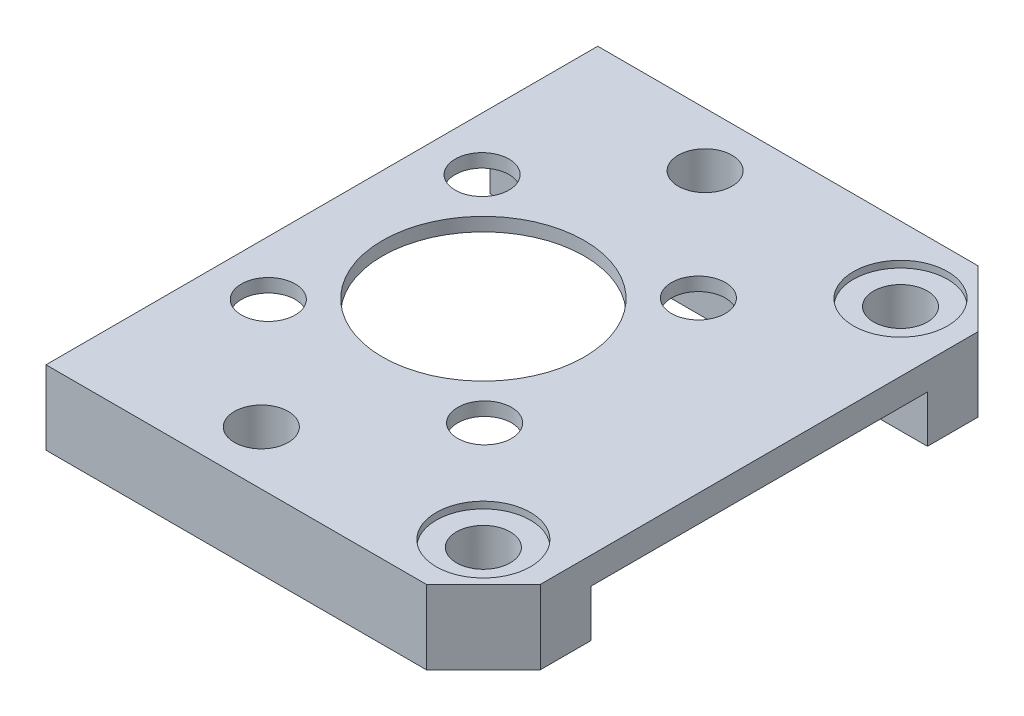
from build123d import *

# Parameters (mm, degrees)
SKETCH2_W           = 41
SKETCH2_H           = 41
BOSS_EXTRUDE1_DEPTH = 2
SKETCH3_R           = 2
CUT_EXTRUDE1_DEPTH  = 30.060282173
SKETCH4_R           = 7.5
CUT_EXTRUDE2_DEPTH  = 30.060282173
SKETCH5_W           = 25
SKETCH5_H           = 25
CUT_EXTRUDE3_DEPTH  = 1
CUT_EXTRUDE4_DEPTH  = 30.060282173
SKETCH7_R           = 2
CUT_EXTRUDE5_DEPTH  = 30.060282173
SKETCH8_W           = 25
SKETCH8_H           = 8
SKETCH8_H_2         = 7.957817611
BOSS_EXTRUDE2_DEPTH = 3.5
SKETCH9_R           = 2
CUT_EXTRUDE6_DEPTH  = 30.508473359
BOSS_EXTRUDE3_START = 3.5
SKETCH10_R          = 2
BOSS_EXTRUDE3_DEPTH = 3.5
SKETCH11_R          = 3.5
CUT_EXTRUDE7_DEPTH  = 3.5
SKETCH12_W          = 8
SKETCH12_H          = 2
BOSS_EXTRUDE4_DEPTH = 3.5
SKETCH13_R          = 3.5
CUT_EXTRUDE8_DEPTH  = 3.5
SKETCH14_R          = 3.5
SKETCH14_R_2        = 2
BOSS_EXTRUDE5_DEPTH = 3
SKETCH15_W          = 16
SKETCH15_H          = 8.042182389
SKETCH15_R          = 2
SKETCH15_H_2        = 8
BOSS_EXTRUDE6_DEPTH = 4
SKETCH16_W          = 8
SKETCH16_H          = 25
CUT_EXTRUDE9_DEPTH  = 3.5
SKETCH18_W          = 32.514718626
SKETCH18_H          = 41
CUT_EXTRUDE10_DEPTH = 4
CUT_EXTRUDE12_DEPTH = 30.508473359


with BuildPart() as part:
    # Sketch2 → Boss-Extrude1 (new body)
    with BuildSketch(Plane(origin=(0, 0, 0), x_dir=(1, 0, 0), z_dir=(0, 1, 0))):
        Rectangle(SKETCH2_W, SKETCH2_H)
    extrude(amount=BOSS_EXTRUDE1_DEPTH)

    # Sketch3 → Cut-Extrude1 (cut, through all)
    with BuildSketch(Plane.XZ):
        with Locations(Location((-7.943181907, 8.037155044, 0), (0, 0, 270))):
            Circle(SKETCH3_R)
        with Locations(Location((8.037155044, 7.943181907, 0), (0, 0, 270))):
            Circle(SKETCH3_R)
        with Locations(Location((7.943181907, -8.037155044, 0), (0, 0, 270))):
            Circle(SKETCH3_R)
        with Locations(Location((-8.037155044, -7.943181907, 0), (0, 0, 270))):
            Circle(SKETCH3_R)
    extrude(amount=-CUT_EXTRUDE1_DEPTH, mode=Mode.SUBTRACT)

    # Sketch4 → Cut-Extrude2 (cut, through all)
    with BuildSketch(Plane(origin=(0, 2, 0), x_dir=(1, 0, 0), z_dir=(0, 1, 0))):
        with Locations(Location((0, 0, 0), (0, 0, 270))):
            Circle(SKETCH4_R)
    extrude(amount=-CUT_EXTRUDE2_DEPTH, mode=Mode.SUBTRACT)

    # Sketch5 → Cut-Extrude3 (cut)
    with BuildSketch(Plane.XZ):
        Rectangle(SKETCH5_W, SKETCH5_H)
    extrude(amount=-CUT_EXTRUDE3_DEPTH, mode=Mode.SUBTRACT)

    # Sketch6 → Cut-Extrude4 (cut, through all)
    with BuildSketch(Plane(origin=(0, 2, 0), x_dir=(1, 0, 0), z_dir=(0, 1, 0))):
        Polygon((-20.5, 16.257359313), (-16.257359313, 20.5), (-20.5, 20.5), align=None)
        Polygon((16.257359313, 20.5), (20.5, 16.257359313), (20.5, 20.5), align=None)
        Polygon((20.5, -16.257359313), (16.257359313, -20.5), (20.5, -20.5), align=None)
        Polygon((-16.257359313, -20.5), (-20.5, -16.257359313), (-20.5, -20.5), align=None)
    extrude(amount=-CUT_EXTRUDE4_DEPTH, mode=Mode.SUBTRACT)

    # Sketch7 → Cut-Extrude5 (cut, through all)
    with BuildSketch(Plane.XZ):
        with Locations(Location((-15.5, 15.5, 0), (0, 0, 270))):
            Circle(SKETCH7_R)
        with Locations(Location((15.5, 15.5, 0), (0, 0, 270))):
            Circle(SKETCH7_R)
        with Locations(Location((15.5, -15.5, 0), (0, 0, 270))):
            Circle(SKETCH7_R)
        with Locations(Location((-15.5, -15.5, 0), (0, 0, 270))):
            Circle(SKETCH7_R)
    extrude(amount=-CUT_EXTRUDE5_DEPTH, mode=Mode.SUBTRACT)

    # Sketch8 → Boss-Extrude2 (add)
    with BuildSketch(Plane.XZ):
        with Locations((0, 16.5)):
            Rectangle(SKETCH8_W, SKETCH8_H)
        with Locations((0, -16.478908806)):
            Rectangle(SKETCH8_W, SKETCH8_H_2)
    extrude(amount=BOSS_EXTRUDE2_DEPTH)

    # Sketch9 → Cut-Extrude6 (cut, through all)
    with BuildSketch(Plane.XZ.offset(3.5)):
        with Locations(Location((0, 16.5, 0), (0, 0, 270))):
            Circle(SKETCH9_R)
        with Locations(Location((0, -16.478908806, 0), (0, 0, 270))):
            Circle(SKETCH9_R)
    extrude(amount=-CUT_EXTRUDE6_DEPTH, mode=Mode.SUBTRACT)

    # Sketch10 → Boss-Extrude3 (add)
    # profile 1 of 3: a face of its own
    with BuildSketch(Plane.XZ.offset(BOSS_EXTRUDE3_START)):
        Polygon((-20.5, 16.257359313), (-20.5, 12.5), (-12.5, 12.5), (-12.5, 20.5), (-16.257359313, 20.5), align=None)
        with Locations(Location((-15.5, 15.5, 0), (0, 0, 270))):
            Circle(SKETCH10_R, mode=Mode.SUBTRACT)
    # profile 2 of 3: a face of its own
    with BuildSketch(Plane.XZ.offset(BOSS_EXTRUDE3_START)):
        Polygon((12.5, 12.5), (20.5, 12.5), (20.5, 16.257359313), (16.257359313, 20.5), (12.5, 20.5), align=None)
        with Locations(Location((15.5, 15.5, 0), (0, 0, 270))):
            Circle(SKETCH10_R, mode=Mode.SUBTRACT)
    # profile 3 of 3: a face of its own
    with BuildSketch(Plane.XZ.offset(BOSS_EXTRUDE3_START)):
        Polygon((-20.5, -12.5), (-20.5, -16.257359313), (-16.257359313, -20.5), (16.257359313, -20.5), (20.5, -16.257359313), (20.5, -12.5), (12.5, -12.5), (12.5, -20.457817611), (-12.5, -20.457817611), (-12.5, -12.5), align=None)
        with Locations(Location((-15.5, -15.5, 0), (0, 0, 270))):
            Circle(SKETCH10_R, mode=Mode.SUBTRACT)
        with Locations(Location((15.5, -15.5, 0), (0, 0, 270))):
            Circle(SKETCH10_R, mode=Mode.SUBTRACT)
    extrude(amount=-BOSS_EXTRUDE3_DEPTH)

    # Sketch11 → Cut-Extrude7 (cut)
    with BuildSketch(Plane(origin=(0, 2, 0), x_dir=(1, 0, 0), z_dir=(0, 1, 0))):
        with Locations(Location((-15.5, 15.5, 0), (0, 0, 270))):
            Circle(SKETCH11_R)
        with Locations(Location((15.5, 15.5, 0), (0, 0, 270))):
            Circle(SKETCH11_R)
        with Locations(Location((15.5, -15.5, 0), (0, 0, 270))):
            Circle(SKETCH11_R)
        with Locations(Location((-15.5, -15.5, 0), (0, 0, 270))):
            Circle(SKETCH11_R)
    extrude(amount=-CUT_EXTRUDE7_DEPTH, mode=Mode.SUBTRACT)

    # Sketch12 → Boss-Extrude4 (add)
    with BuildSketch(Plane.XZ):
        with Locations((-16.5, -11.5)):
            Rectangle(SKETCH12_W, SKETCH12_H)
        with Locations((-16.5, 11.5)):
            Rectangle(SKETCH12_W, SKETCH12_H)
        with Locations((16.5, -11.5)):
            Rectangle(SKETCH12_W, SKETCH12_H)
        with Locations((16.5, 11.5)):
            Rectangle(SKETCH12_W, SKETCH12_H)
    extrude(amount=BOSS_EXTRUDE4_DEPTH)

    # Sketch13 → Cut-Extrude8 (cut)
    with BuildSketch(Plane(origin=(0, 2, 0), x_dir=(1, 0, 0), z_dir=(0, 1, 0))):
        with Locations(Location((-15.5, 15.5, 0), (0, 0, 270))):
            Circle(SKETCH13_R)
        with Locations(Location((15.5, 15.5, 0), (0, 0, 270))):
            Circle(SKETCH13_R)
        with Locations(Location((15.5, -15.5, 0), (0, 0, 270))):
            Circle(SKETCH13_R)
        with Locations(Location((-15.5, -15.5, 0), (0, 0, 270))):
            Circle(SKETCH13_R)
    extrude(amount=-CUT_EXTRUDE8_DEPTH, mode=Mode.SUBTRACT)

    # Sketch14 → Boss-Extrude5 (add)
    # profile 1 of 4: a face of its own
    with BuildSketch(Plane(origin=(0, -1.5, 0), x_dir=(1, 0, 0), z_dir=(0, 1, 0))):
        with Locations(Location((-15.5, -15.5, 0), (0, 0, 270))):
            Circle(SKETCH14_R)
        with Locations(Location((-15.5, -15.5, 0), (0, 0, 90))):
            Circle(SKETCH14_R_2, mode=Mode.SUBTRACT)
    # profile 2 of 4: a face of its own
    with BuildSketch(Plane(origin=(0, -1.5, 0), x_dir=(1, 0, 0), z_dir=(0, 1, 0))):
        with Locations(Location((-15.5, 15.5, 0), (0, 0, 270))):
            Circle(SKETCH14_R)
        with Locations(Location((-15.5, 15.5, 0), (0, 0, 90))):
            Circle(SKETCH14_R_2, mode=Mode.SUBTRACT)
    # profile 3 of 4: a face of its own
    with BuildSketch(Plane(origin=(0, -1.5, 0), x_dir=(1, 0, 0), z_dir=(0, 1, 0))):
        with Locations(Location((15.5, 15.5, 0), (0, 0, 270))):
            Circle(SKETCH14_R)
        with Locations(Location((15.5, 15.5, 0), (0, 0, 90))):
            Circle(SKETCH14_R_2, mode=Mode.SUBTRACT)
    # profile 4 of 4: a face of its own
    with BuildSketch(Plane(origin=(0, -1.5, 0), x_dir=(1, 0, 0), z_dir=(0, 1, 0))):
        with Locations(Location((15.5, -15.5, 0), (0, 0, 270))):
            Circle(SKETCH14_R)
        with Locations(Location((15.5, -15.5, 0), (0, 0, 90))):
            Circle(SKETCH14_R_2, mode=Mode.SUBTRACT)
    extrude(amount=BOSS_EXTRUDE5_DEPTH)

    # Sketch15 → Boss-Extrude6 (add)
    # profile 1 of 2: a face of its own
    with BuildSketch(Plane(origin=(0, 2, 0), x_dir=(1, 0, 0), z_dir=(0, 1, 0))):
        with Locations((0, 16.478908806)):
            Rectangle(SKETCH15_W, SKETCH15_H)
        with Locations(Location((0, 16.478908806, 0), (0, 0, 90))):
            Circle(SKETCH15_R, mode=Mode.SUBTRACT)
    # profile 2 of 2: a face of its own
    with BuildSketch(Plane(origin=(0, 2, 0), x_dir=(1, 0, 0), z_dir=(0, 1, 0))):
        with Locations((0, -16.5)):
            Rectangle(SKETCH15_W, SKETCH15_H_2)
        with Locations(Location((0, -16.478908806, 0), (0, 0, 90))):
            Circle(SKETCH15_R, mode=Mode.SUBTRACT)
    extrude(amount=BOSS_EXTRUDE6_DEPTH)

    # Sketch16 → Cut-Extrude9 (cut)
    with BuildSketch(Plane.XZ.offset(3.5)):
        with Locations((-16.5, 0)):
            Rectangle(SKETCH16_W, SKETCH16_H)
        with Locations((16.5, 0)):
            Rectangle(SKETCH16_W, SKETCH16_H)
    extrude(amount=-CUT_EXTRUDE9_DEPTH, mode=Mode.SUBTRACT)

    # Sketch18 → Cut-Extrude10 (cut)
    with BuildSketch(Plane(origin=(0, 6, 0), x_dir=(1, 0, 0), z_dir=(0, 1, 0))):
        Rectangle(SKETCH18_W, SKETCH18_H)
    extrude(amount=-CUT_EXTRUDE10_DEPTH, mode=Mode.SUBTRACT)

    # Sketch19 → Cut-Extrude12 (cut, through all)
    with BuildSketch(Plane(origin=(0, 2, 0), x_dir=(1, 0, 0), z_dir=(0, 1, 0))):
        Polygon((-12, 20.5), (-12, -20.5), (-16.257359313, -20.5), (-20.5, -16.257359313), (-20.5, 16.257359313), (-16.257359313, 20.5), align=None)
    extrude(amount=-CUT_EXTRUDE12_DEPTH, mode=Mode.SUBTRACT)


solid = part.part
